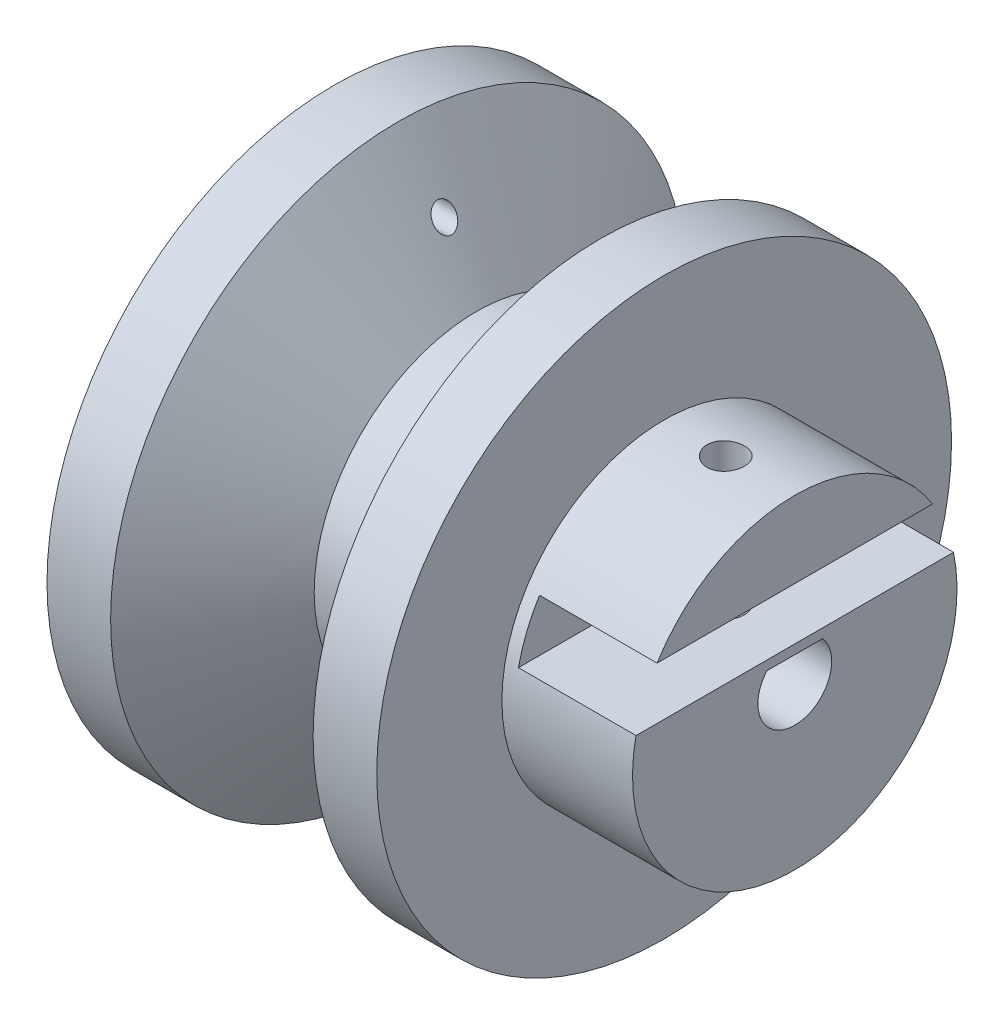
from build123d import *

# Parameters (mm, degrees)
SKETCH_3_R          = 2.825
CUT_EXTRUDE_2_DEPTH = 35
SKETCH_14_R         = 0.877374271
CUT_EXTRUDE_5_DEPTH = 12
SKETCH_16_W         = 5.008881277
SKETCH_16_H         = 1
EXTRUDE_2_DEPTH     = 30
SKETCH_19_W         = 0.959066555
SKETCH_19_H         = 0.511502163
EXTRUDE_3_DEPTH     = 30
SKETCH_24_W         = 24.30212029
SKETCH_24_H         = 4
CUT_EXTRUDE_8_DEPTH = 9
SKETCH_25_R         = 1.43
CUT_EXTRUDE_9_DEPTH = 22


with BuildPart() as part:
    # 草圖1 → 旋轉1 (revolve)
    with BuildSketch(Plane.XY):
        Polygon((0, 0), (0, 22), (4.87, 22), (10.87, 12.418858447), (14.37, 12.418858447), (20.37, 22), (25.24, 22), (25.24, 12.418858447), (35.24, 12.418858447), (35.24, 0), align=None)
    revolve(axis=Axis((-743.15639781, 0, 0), (1, 0, 0)))

    # 草圖3 → 除料-伸長2 (cut)
    with BuildSketch(Plane(origin=(35.24, 0, 0), x_dir=(0, 0, -1), z_dir=(1, 0, 0))):
        Circle(SKETCH_3_R)
    extrude(amount=-CUT_EXTRUDE_2_DEPTH, mode=Mode.SUBTRACT)

    # 草圖14 → 除料-伸長5 (cut)
    with BuildSketch(Plane.ZY):
        with Locations((-0.435299539, 17.00388826)):
            Circle(SKETCH_14_R)
    extrude(amount=-CUT_EXTRUDE_5_DEPTH, mode=Mode.SUBTRACT)

    # 草圖16 → 填料-伸長2 (add)
    with BuildSketch(Plane(origin=(35.24, 0, 0), x_dir=(0, 0, -1), z_dir=(1, 0, 0))):
        with Locations((-0.105543204, 2.350977924)):
            Rectangle(SKETCH_16_W, SKETCH_16_H)
    extrude(amount=-EXTRUDE_2_DEPTH)

    # 草圖19 → 填料-伸長3 (add)
    with BuildSketch(Plane(origin=(35.24, 0, 0), x_dir=(0, 0, -1), z_dir=(1, 0, 0))):
        with Locations((-0.084116996, 2.673942601)):
            Rectangle(SKETCH_19_W, SKETCH_19_H)
    extrude(amount=-EXTRUDE_3_DEPTH)

    # 草圖24 → 除料-伸長8 (cut)
    with BuildSketch(Plane(origin=(35.24, 0, 0), x_dir=(0, 0, -1), z_dir=(1, 0, 0))):
        with Locations((0, 4.565108671)):
            Rectangle(SKETCH_24_W, SKETCH_24_H)
    extrude(amount=-CUT_EXTRUDE_8_DEPTH, mode=Mode.SUBTRACT)

    # 草圖25 → 除料-伸長9 (cut)
    with BuildSketch(Plane(origin=(0, 22, 0), x_dir=(1, 0, 0), z_dir=(0, 1, 0))):
        with Locations((29.956679037, 0)):
            Circle(SKETCH_25_R)
    extrude(amount=-CUT_EXTRUDE_9_DEPTH, mode=Mode.SUBTRACT)


solid = part.part
